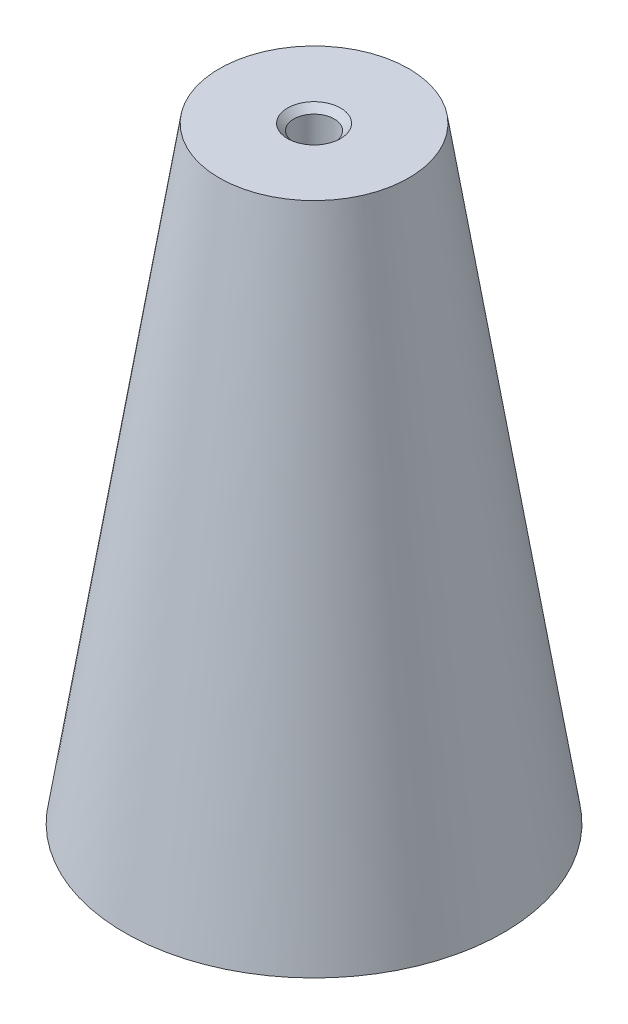
from build123d import *

# Parameters (mm, degrees)
SKETCH_4_R          = 1.6
CUT_EXTRUDE_1_DEPTH = 10
CHAMFER_1_SIZE      = 0.5


with BuildPart() as part:
    # 草图3 → 旋转1 (revolve)
    with BuildSketch(Plane(origin=(0, 0, 0), x_dir=(0, 0, -1), z_dir=(1, 0, 0)), mode=Mode.PRIVATE) as revolve_1_sk:
        Polygon((-7.5, 0), (0, 0), (0, -4), (-4.125, -4), (-11, -48), (-15, -48), align=None)
    revolve(revolve_1_sk.sketch.rotate(Axis((0, 28.450677981, 0), (0, 1, 0)), 180), axis=Axis((0, 28.450677981, 0), (0, 1, 0)))

    # 草图4 → 切除-拉伸1 (cut)
    with BuildSketch(Plane(origin=(0, 0, 0), x_dir=(1, 0, 0), z_dir=(0, 1, 0))):
        with Locations(Location((0, 0, 0), (0, 0, 270))):
            Circle(SKETCH_4_R)
    extrude(amount=-CUT_EXTRUDE_1_DEPTH, mode=Mode.SUBTRACT)

    # 倒角1
    chamfer_1_edges = [part.edges().sort_by_distance(p)[0] for p in [
        (0, -4, -1.6),
        (0, 0, -1.6),
    ]]
    chamfer(chamfer_1_edges, length=CHAMFER_1_SIZE)


solid = part.part
